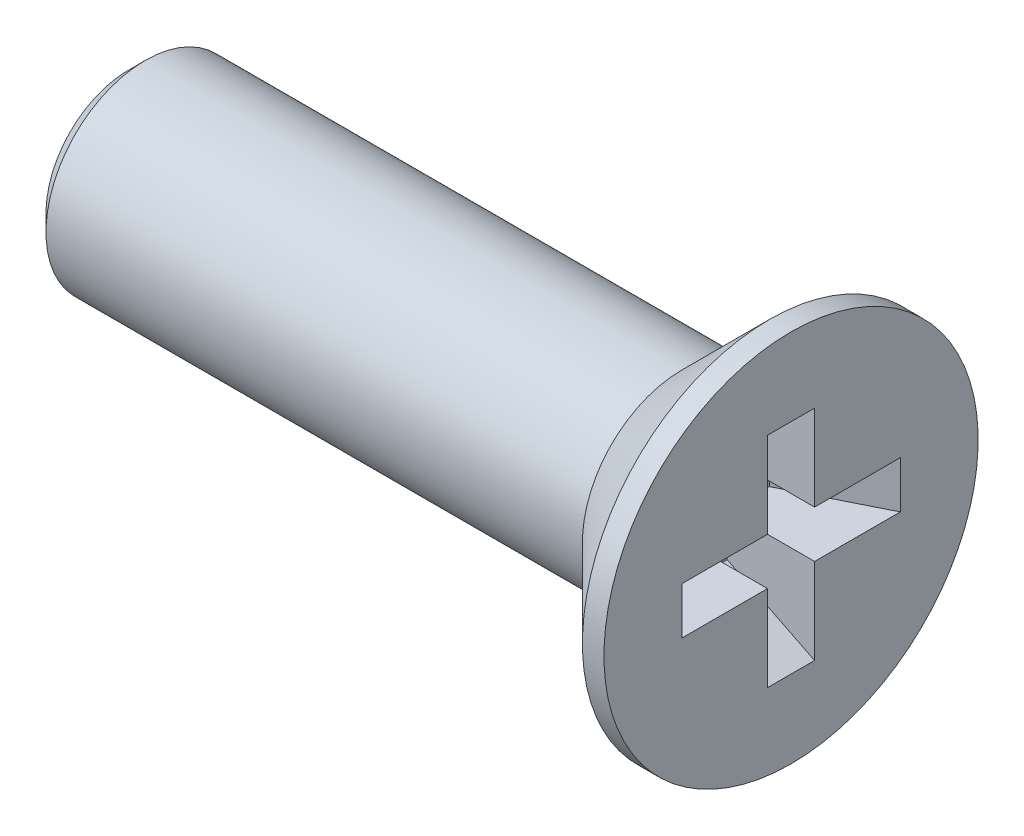
from build123d import *

# Parameters (mm, degrees)
SKETCH2_W          = 1.42
SKETCH2_H          = 2.59
SKETCH2_W_2        = 2.59
SKETCH2_H_2        = 1.42
CUT_EXTRUDE1_DEPTH = 2.64
DRAFT1_ANGLE       = 26.5
CHAMFER1_SIZE      = 0.5


with BuildPart() as part:
    # Sketch1 → Revolve1 (revolve)
    with BuildSketch(Plane.XY):
        Polygon((0, 0), (0, 5.65), (-0.65, 5.65), (-3.3, 3), (-20, 3), (-20, 0), align=None)
    revolve(axis=Axis((0, 0, 0), (-1, 0, 0)))

    # Sketch2 → Cut-Extrude1 (cut)
    with BuildSketch(Plane(origin=(0, 0, 0), x_dir=(0, 0, -1), z_dir=(1, 0, 0))):
        with Locations((0, 2.005)):
            Rectangle(SKETCH2_W, SKETCH2_H)
        with Locations((-2.005, 0)):
            Rectangle(SKETCH2_W_2, SKETCH2_H_2)
        Rectangle(SKETCH2_W, SKETCH2_H_2)
        with Locations((2.005, 0)):
            Rectangle(SKETCH2_W_2, SKETCH2_H_2)
        with Locations((0, -2.005)):
            Rectangle(SKETCH2_W, SKETCH2_H)
    extrude(amount=-CUT_EXTRUDE1_DEPTH, mode=Mode.SUBTRACT)

    # Draft1
    draft1_faces = [part.faces().sort_by_distance(p)[0] for p in [
        (-1.32, 0, -3.3),
        (-1.32, -3.3, 0),
        (-1.32, 0, 3.3),
        (-1.32, 3.3, 0),
    ]]
    draft(draft1_faces, Plane.YZ, DRAFT1_ANGLE)

    # Chamfer1
    chamfer1_edges = [part.edges().sort_by_distance(p)[0] for p in [
        (-20, -3, 0),
    ]]
    chamfer(chamfer1_edges, length=CHAMFER1_SIZE)


solid = part.part
